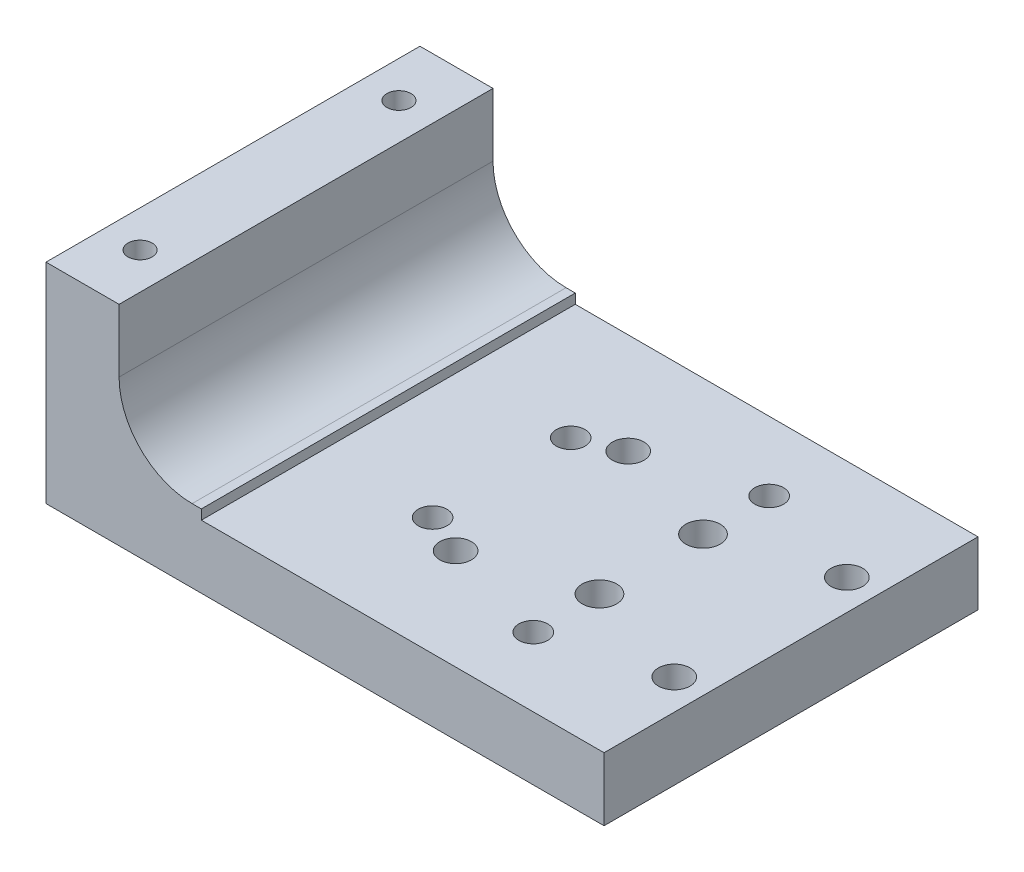
from build123d import *

# Parameters (mm, degrees)
EXTRUDE1_DEPTH            = 32.5
SKETCH2_W                 = 70
SKETCH2_H                 = 1.7
CUT_EXTRUDE1_DEPTH        = 123.291955991
M5_CLEARANCE_HOLE1_D      = 5.5
M5X0_8_TAPPED_HOLE1_D     = 4.2
M5X0_8_TAPPED_HOLE1_DEPTH = 19.05
M5X0_8_TAPPED_HOLE1_TIP   = 1.2618073
F_5_0_5_DIAMETER_HOLE1_D  = 5
M6X1_0_TAPPED_HOLE1_D     = 5
F_6_0_6_DIAMETER_HOLE1_D  = 6


with BuildPart() as part:
    # Sketch1 → Extrude1 (new, symmetric)
    with BuildSketch(Plane.XY):
        with BuildLine():
            Line((0, 0), (97, 0))
            Line((97, 0), (97, 12.7))
            Line((97, 12.7), (25.4, 12.7))
            ThreePointArc((25.4, 12.7), (16.419743879, 16.419743879), (12.7, 25.4))
            Line((12.7, 25.4), (12.7, 36.35))
            Line((12.7, 36.35), (0, 36.35))
            Line((0, 36.35), (0, 0))
        make_face()
    extrude(amount=EXTRUDE1_DEPTH, both=True)

    # Sketch2 → Cut-Extrude1 (cut, through all)
    with BuildSketch(Plane(origin=(0, 0, -32.5), x_dir=(-1, 0, 0), z_dir=(0, 0, -1))):
        with Locations((-62, 11.85)):
            Rectangle(SKETCH2_W, SKETCH2_H)
    extrude(amount=-CUT_EXTRUDE1_DEPTH, mode=Mode.SUBTRACT)

    # M5 Clearance Hole1 (through all)
    with Locations(Plane.XZ):
        with Locations((53.7, 15), (91.7, 15), (91.7, -15), (53.7, -15)):
            Hole(M5_CLEARANCE_HOLE1_D / 2)

    # M5x0.8 Tapped Hole1
    with Locations(Plane(origin=(0, 36.35, 0), x_dir=(-1, 0, 0), z_dir=(0, 1, 0))):
        with Locations((-6.35, 22.5), (-6.35, -22.5)):
            Hole(M5X0_8_TAPPED_HOLE1_D / 2, depth=M5X0_8_TAPPED_HOLE1_DEPTH)
            with Locations((0, 0, -(M5X0_8_TAPPED_HOLE1_DEPTH + M5X0_8_TAPPED_HOLE1_TIP / 2))):  # 118° drill point
                Cone(0, M5X0_8_TAPPED_HOLE1_D / 2, M5X0_8_TAPPED_HOLE1_TIP, mode=Mode.SUBTRACT)

    # Ø5.0 (5) Diameter Hole1 (through all)
    with Locations(Plane.XZ):
        with Locations((46.70001183, 12), (46.70001183, -12)):
            Hole(F_5_0_5_DIAMETER_HOLE1_D / 2)

    # M6x1.0 Tapped Hole1 (through all)
    with Locations(Plane.XZ):
        with Locations((72.7, 20.5), (72.7, -20.5)):
            Hole(M6X1_0_TAPPED_HOLE1_D / 2)

    # Ø6.0 (6) Diameter Hole1 (through all)
    with Locations(Plane.XZ):
        with Locations((72.7, -9), (72.7, 9)):
            Hole(F_6_0_6_DIAMETER_HOLE1_D / 2)


solid = part.part
